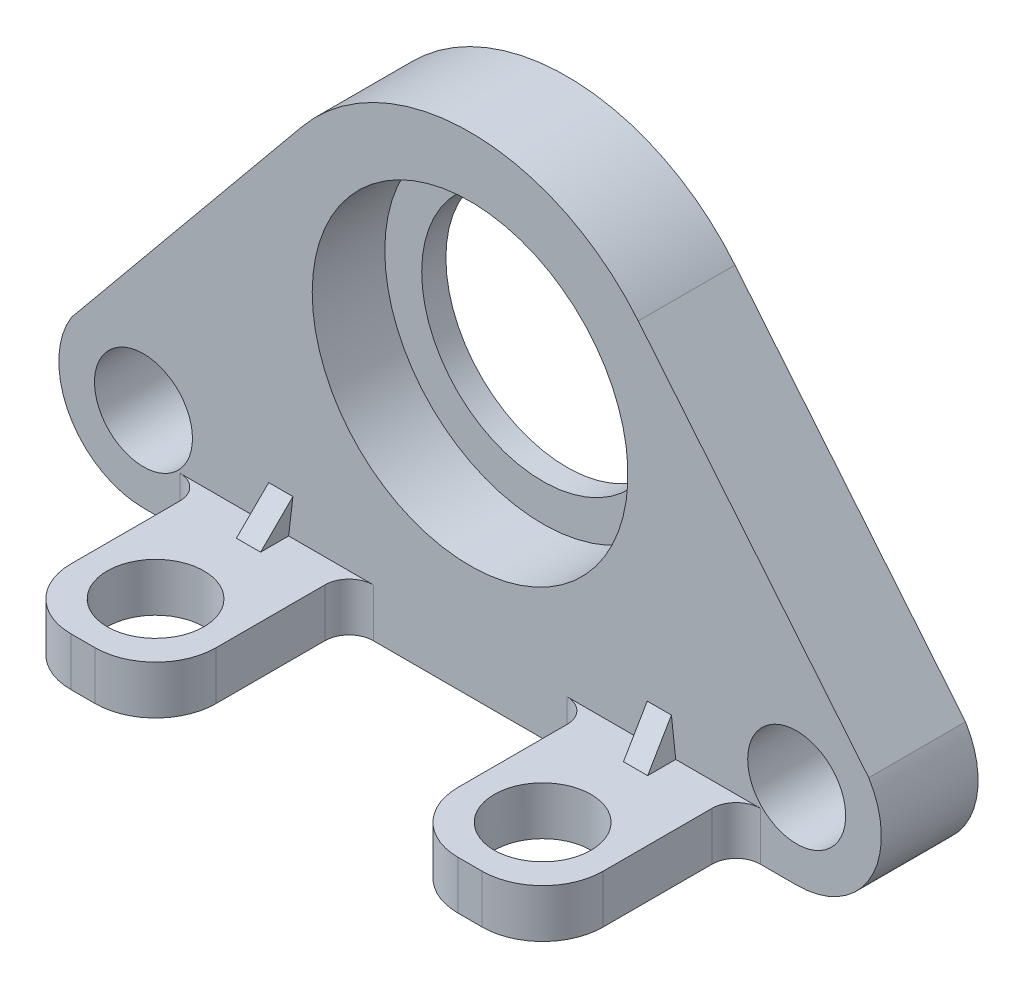
from build123d import *

# Parameters (mm, degrees)
SALIENTE_EXTRUIR1_DEPTH = 23
SALIENTE_EXTRUIR2_DEPTH = 2
CROQUIS3_W              = 74.8935
CROQUIS3_H              = 50
SALIENTE_EXTRUIR3_DEPTH = 2
CROQUIS4_R              = 4.05
SALIENTE_EXTRUIR4_DEPTH = 50
CHAFL_N2_SIZE           = 1
CROQUIS7_R              = 4.05
CROQUIS7_R_2            = 13.05
SALIENTE_EXTRUIR5_DEPTH = 6
CROQUIS8_W              = 12
CROQUIS8_H              = 4
SALIENTE_EXTRUIR6_DEPTH = 16
REDONDEO3_R             = 2
REDONDEO4_R             = 5
CROQUIS14_R             = 4
CORTAR_EXTRUIR1_DEPTH   = 10
SALIENTE_EXTRUIR7_DEPTH = 1
CROQUIS20_R             = 4.05
CROQUIS20_R_2           = 10
SALIENTE_EXTRUIR8_DEPTH = 2
CHAFL_N3_SIZE           = 1


with BuildPart() as part:
    # Croquis1 → Saliente-Extruir1 (new, symmetric)
    with BuildSketch(Plane.XY):
        Polygon((-7.48935, 0), (7.48935, 0), (0.00065, 21.6199), align=None)
    extrude(amount=SALIENTE_EXTRUIR1_DEPTH, both=True)

    # Croquis2 → Saliente-Extruir2 (add)
    with BuildSketch(Plane.XY.offset(23)):
        Polygon((37.44675, 0), (-37.44675, 0), (0.00065, 21.6199), align=None)
    saliente_extruir2 = extrude(amount=SALIENTE_EXTRUIR2_DEPTH)

    # Simetría1: Saliente-Extruir2 across plane
    add(saliente_extruir2.mirror(Plane.XY))

    # Croquis3 → Saliente-Extruir3 (add)
    with BuildSketch(Plane.XZ):
        Rectangle(CROQUIS3_W, CROQUIS3_H)
    extrude(amount=SALIENTE_EXTRUIR3_DEPTH)

    # Croquis4 → Saliente-Extruir4 (add)
    with BuildSketch(Plane.XY.offset(25)):
        with BuildLine():
            Line((7.743545699, -2), (-7.743545699, -2))
            ThreePointArc((-7.743545699, -2), (-6.147743753, -2.794422898), (-5.819683414, -4.546583851))
            ThreePointArc((-5.819683414, -4.546583851), (0, -12.25), (5.819683414, -4.546583851))
            ThreePointArc((5.819683414, -4.546583851), (6.147743753, -2.794422898), (7.743545699, -2))
        make_face()
        with Locations((0, -6.2)):
            Circle(CROQUIS4_R, mode=Mode.SUBTRACT)
    extrude(amount=-SALIENTE_EXTRUIR4_DEPTH)

    # Chaflán2
    chafl_n2_edges = [part.edges().sort_by_distance(p)[0] for p in [
        (-4.05, -6.2, -25),
        (-4.05, -6.2, 25),
    ]]
    chamfer(chafl_n2_edges, length=CHAFL_N2_SIZE)


with BuildPart() as body_2:
    # Croquis7 → Saliente-Extruir5 (new body)
    with BuildSketch(Plane(origin=(0, 0, -25), x_dir=(-1, 0, 0), z_dir=(0, 0, -1))):
        with BuildLine():
            Line((27, -28.615252187), (-27, -28.615252187))
            ThreePointArc((-27, -28.615252187), (-33.112686004, -25.026274001), (-32.957287229, -17.939557849))
            Line((-32.957287229, -17.939557849), (-13.903204494, 5.232449641))
            ThreePointArc((-13.903204494, 5.232449641), (0, 11.8), (13.903204494, 5.232449641))
            Line((13.903204494, 5.232449641), (32.957287229, -17.939557849))
            ThreePointArc((32.957287229, -17.939557849), (33.112686004, -25.026274001), (27, -28.615252187))
        make_face()
        with Locations((-27, -21.615252187)):
            Circle(CROQUIS7_R, mode=Mode.SUBTRACT)
        with Locations(Location((27, -21.615252187, 0), (0, 0, 180))):
            Circle(CROQUIS7_R, mode=Mode.SUBTRACT)
        with Locations((0, -6.2)):
            Circle(CROQUIS7_R_2, mode=Mode.SUBTRACT)
    extrude(amount=SALIENTE_EXTRUIR5_DEPTH)

    # Croquis8 → Saliente-Extruir6 (add)
    with BuildSketch(Plane.XY.offset(-25)):
        with Locations((-16, -26.615252187)):
            Rectangle(CROQUIS8_W, CROQUIS8_H)
        with Locations((16, -26.615252187)):
            Rectangle(CROQUIS8_W, CROQUIS8_H)
    extrude(amount=SALIENTE_EXTRUIR6_DEPTH)

    # Redondeo3
    redondeo3_edges = [body_2.edges().sort_by_distance(p)[0] for p in [
        (-22, -26.615252187, -25),
        (-10, -26.615252187, -25),
        (22, -26.615252187, -25),
        (10, -26.615252187, -25),
    ]]
    fillet(redondeo3_edges, radius=REDONDEO3_R)

    # Redondeo4
    redondeo4_edges = [body_2.edges().sort_by_distance(p)[0] for p in [
        (-22, -26.615252187, -9),
        (-10, -26.615252187, -9),
        (22, -26.615252187, -9),
        (10, -26.615252187, -9),
    ]]
    fillet(redondeo4_edges, radius=REDONDEO4_R)

    # Croquis14 → Cortar-Extruir1 (cut)
    with BuildSketch(Plane(origin=(0, -24.615252187, 0), x_dir=(1, 0, 0), z_dir=(0, 1, 0))):
        with Locations(Location((-16, 15, 0), (0, 0, 270))):
            Circle(CROQUIS14_R)
        with Locations(Location((16, 15, 0), (0, 0, 270))):
            Circle(CROQUIS14_R)
    extrude(amount=-CORTAR_EXTRUIR1_DEPTH, mode=Mode.SUBTRACT)

    # Croquis3D2 → Saliente-Extruir7 (add, symmetric, along a direction that is not the sketch's normal)
    with BuildSketch(Plane(origin=(-16, -24.615252187, -22.681195735), x_dir=(0.09307928640942055, 0.7877707078361105, -0.6088953590863595), z_dir=(-0.9930919098636288, 0.11733907517707019, 0))):
        Polygon((0, 0), (3.808214713, 0), (1.411909156, 1.839392768), align=None)
    saliente_extruir7 = extrude(amount=SALIENTE_EXTRUIR7_DEPTH, dir=(-1, 0, 0), both=True)

    # Simetría2: Saliente-Extruir7 across plane
    add(saliente_extruir7.mirror(Plane(origin=(0, 0, 0), x_dir=(0, 0, 1), z_dir=(1, 0, 0))))

    # Croquis20 → Saliente-Extruir8 (add)
    with BuildSketch(Plane(origin=(0, 0, -31), x_dir=(-1, 0, 0), z_dir=(0, 0, -1))):
        with BuildLine():
            Line((32.957287229, -17.939557849), (13.903204494, 5.232449641))
            ThreePointArc((13.903204494, 5.232449641), (0, 11.8), (-13.903204494, 5.232449641))
            Line((-13.903204494, 5.232449641), (-32.957287229, -17.939557849))
            ThreePointArc((-32.957287229, -17.939557849), (-33.112686004, -25.026274001), (-27, -28.615252187))
            Line((-27, -28.615252187), (27, -28.615252187))
            ThreePointArc((27, -28.615252187), (33.112686004, -25.026274001), (32.957287229, -17.939557849))
        make_face()
        with Locations((-27, -21.615252187)):
            Circle(CROQUIS20_R, mode=Mode.SUBTRACT)
        with Locations(Location((27, -21.615252187, 0), (0, 0, 180))):
            Circle(CROQUIS20_R, mode=Mode.SUBTRACT)
        with Locations((0, -6.2)):
            Circle(CROQUIS20_R_2, mode=Mode.SUBTRACT)
    extrude(amount=SALIENTE_EXTRUIR8_DEPTH)

    # Chaflán3
    chafl_n3_edges = [body_2.edges().sort_by_distance(p)[0] for p in [
        (31.05, -21.615252187, -33),
        (-31.05, -21.615252187, -33),
    ]]
    chamfer(chafl_n3_edges, length=CHAFL_N3_SIZE)


solid = body_2.part
